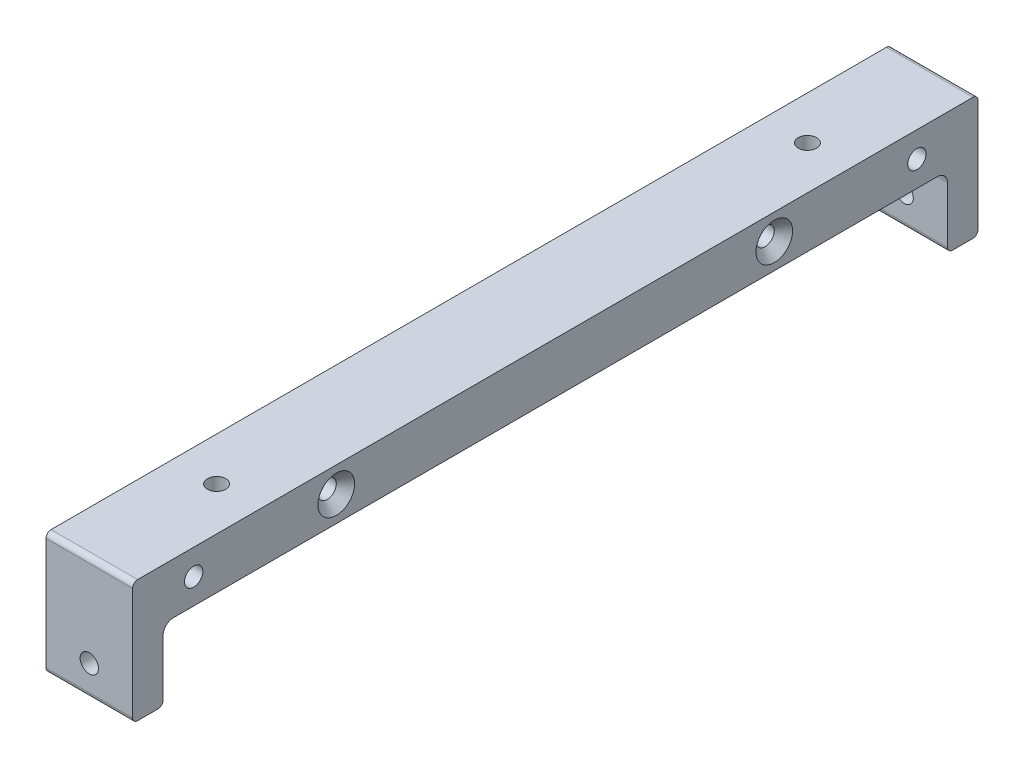
from build123d import *

# Parameters (mm, degrees)
SKETCH1_W                        = 8.5
SKETCH1_H                        = 12
BOSS_EXTRUDE1_DEPTH              = 41.5
CUT_EXTRUDE1_DEPTH               = 43.784342931
M1_6_HOLE1_FIXINGPCB_D           = 1.8
M1_6_HOLE1_FIXINGPCB_CSINK_D     = 3.6
M1_6_HOLE1_FIXINGPCB_CSINK_ANGLE = 90
FILLET1_R                        = 0.5
M1_6_HOLE2_INTUNION_D            = 1.8
M1_6_HOLE2_INTUNION_DEPTH        = 200
M1_6_HOLE2_INTUNION_TIP          = 0.540774557
M1_6_HOLE3_EXTUNION_D            = 1.8
M1_6_HOLE3_EXTUNION_DEPTH        = 3
M1_6_HOLE3_EXTUNION_TIP          = 0.540774557
M1_6_HOLE4_TOPUNION_D            = 1.8
M1_6_HOLE4_TOPUNION_DEPTH        = 3
M1_6_HOLE4_TOPUNION_TIP          = 0.540774557
M1_6_CLEARANCE_HOLE1_D           = 1.8
M1_6_CLEARANCE_HOLE1_DEPTH       = 3
M1_6_CLEARANCE_HOLE1_TIP         = 0.540774557


with BuildPart() as part:
    # Sketch1 → Boss-Extrude1 (new, symmetric)
    with BuildSketch(Plane.XY):
        Rectangle(SKETCH1_W, SKETCH1_H)
    extrude(amount=BOSS_EXTRUDE1_DEPTH, both=True)

    # Sketch2 → Cut-Extrude1 (cut, through all)
    with BuildSketch(Plane(origin=(4.25, 0, 0), x_dir=(0, 0, -1), z_dir=(1, 0, 0))):
        with BuildLine():
            Line((-37.5, 1), (37.5, 1))
            ThreePointArc((37.5, 1), (38.207106781, 0.707106781), (38.5, 0))
            Line((38.5, 0), (38.5, -6))
            Line((38.5, -6), (-38.5, -6))
            Line((-38.5, -6), (-38.5, 0))
            ThreePointArc((-38.5, 0), (-38.207106781, 0.707106781), (-37.5, 1))
        make_face()
    extrude(amount=-CUT_EXTRUDE1_DEPTH, mode=Mode.SUBTRACT)

    # M1.6 Hole1-FixingPCB (through all)
    with Locations(Plane(origin=(4.25, 0, 0), x_dir=(0, 0, -1), z_dir=(1, 0, 0))):
        with Locations((-21.5, 3.5), (21.5, 3.5)):
            CounterSinkHole(M1_6_HOLE1_FIXINGPCB_D / 2, M1_6_HOLE1_FIXINGPCB_CSINK_D / 2, counter_sink_angle=M1_6_HOLE1_FIXINGPCB_CSINK_ANGLE)

    # Fillet1
    fillet1_edges = [part.edges().sort_by_distance(p)[0] for p in [
        (0, -6, 41.5),
        (0, -6, -38.5),
        (0, -6, 38.5),
        (0, -6, -41.5),
        (0, 6, -41.5),
        (0, 6, 41.5),
    ]]
    fillet(fillet1_edges, radius=FILLET1_R)

    # M1.6 Hole2-IntUnion
    with Locations(Plane.XY.offset(41.5)):
        with Locations((0, -3)):
            Hole(M1_6_HOLE2_INTUNION_D / 2, depth=M1_6_HOLE2_INTUNION_DEPTH)
            with Locations((0, 0, -(M1_6_HOLE2_INTUNION_DEPTH + M1_6_HOLE2_INTUNION_TIP / 2))):  # 118° drill point
                Cone(0, M1_6_HOLE2_INTUNION_D / 2, M1_6_HOLE2_INTUNION_TIP, mode=Mode.SUBTRACT)

    # M1.6 Hole3-ExtUnion
    with Locations(Plane(origin=(4.25, 0, 0), x_dir=(0, 0, -1), z_dir=(1, 0, 0))):
        with Locations((-35.5, 3.5), (35.5, 3.5)):
            Hole(M1_6_HOLE3_EXTUNION_D / 2, depth=M1_6_HOLE3_EXTUNION_DEPTH)
            with Locations((0, 0, -(M1_6_HOLE3_EXTUNION_DEPTH + M1_6_HOLE3_EXTUNION_TIP / 2))):  # 118° drill point
                Cone(0, M1_6_HOLE3_EXTUNION_D / 2, M1_6_HOLE3_EXTUNION_TIP, mode=Mode.SUBTRACT)

    # M1.6 Hole4-TopUnion
    with Locations(Plane.ZY.offset(4.25)):
        with Locations((0, 3.5)):
            Hole(M1_6_HOLE4_TOPUNION_D / 2, depth=M1_6_HOLE4_TOPUNION_DEPTH)
            with Locations((0, 0, -(M1_6_HOLE4_TOPUNION_DEPTH + M1_6_HOLE4_TOPUNION_TIP / 2))):  # 118° drill point
                Cone(0, M1_6_HOLE4_TOPUNION_D / 2, M1_6_HOLE4_TOPUNION_TIP, mode=Mode.SUBTRACT)

    # M1.6 Clearance Hole1
    with Locations(Plane(origin=(0, 6, 0), x_dir=(1, 0, 0), z_dir=(0, 1, 0))):
        with Locations((0, 29), (0, -29)):
            Hole(M1_6_CLEARANCE_HOLE1_D / 2, depth=M1_6_CLEARANCE_HOLE1_DEPTH)
            with Locations((0, 0, -(M1_6_CLEARANCE_HOLE1_DEPTH + M1_6_CLEARANCE_HOLE1_TIP / 2))):  # 118° drill point
                Cone(0, M1_6_CLEARANCE_HOLE1_D / 2, M1_6_CLEARANCE_HOLE1_TIP, mode=Mode.SUBTRACT)


solid = part.part
